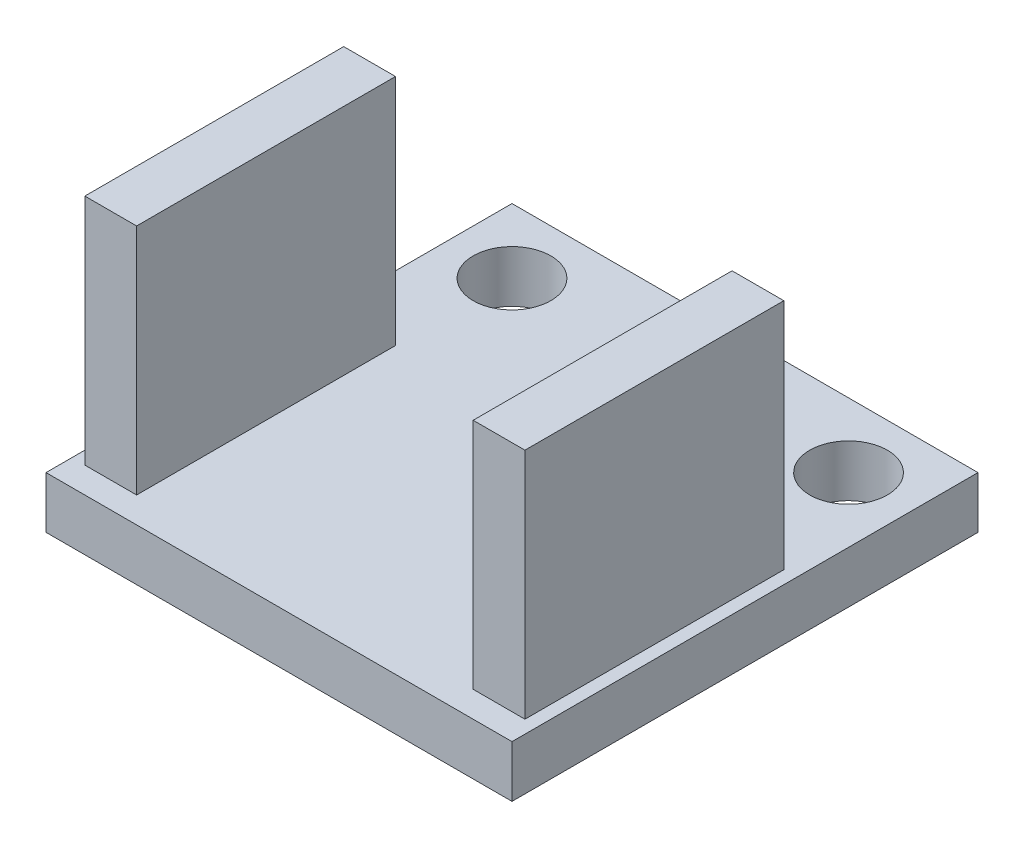
from build123d import *

# Parameters (mm, degrees)
SKETCH1_W           = 18
SKETCH1_H           = 18
BOSS_EXTRUDE1_DEPTH = 2
SKETCH2_R           = 1.5
CUT_EXTRUDE1_DEPTH  = 2
SKETCH3_W           = 2
SKETCH3_H           = 10
BOSS_EXTRUDE2_DEPTH = 9


with BuildPart() as part:
    # Sketch1 → Boss-Extrude1 (new body)
    with BuildSketch(Plane(origin=(0, 0, 0), x_dir=(1, 0, 0), z_dir=(0, 1, 0))):
        with Locations((9, -9)):
            Rectangle(SKETCH1_W, SKETCH1_H)
    extrude(amount=BOSS_EXTRUDE1_DEPTH)

    # Sketch2 → Cut-Extrude1 (cut)
    with BuildSketch(Plane(origin=(0, 2, 0), x_dir=(1, 0, 0), z_dir=(0, 1, 0))):
        with Locations(Location((2.5, -2.5, 0), (0, 0, 270))):
            Circle(SKETCH2_R)
        with Locations(Location((15.5, -2.5, 0), (0, 0, 270))):
            Circle(SKETCH2_R)
    extrude(amount=-CUT_EXTRUDE1_DEPTH, mode=Mode.SUBTRACT)

    # Sketch3 → Boss-Extrude2 (add)
    with BuildSketch(Plane(origin=(0, 2, 0), x_dir=(1, 0, 0), z_dir=(0, 1, 0))):
        with Locations((1.5, -12)):
            Rectangle(SKETCH3_W, SKETCH3_H)
        with Locations((16.5, -12)):
            Rectangle(SKETCH3_W, SKETCH3_H)
    extrude(amount=BOSS_EXTRUDE2_DEPTH)


solid = part.part
